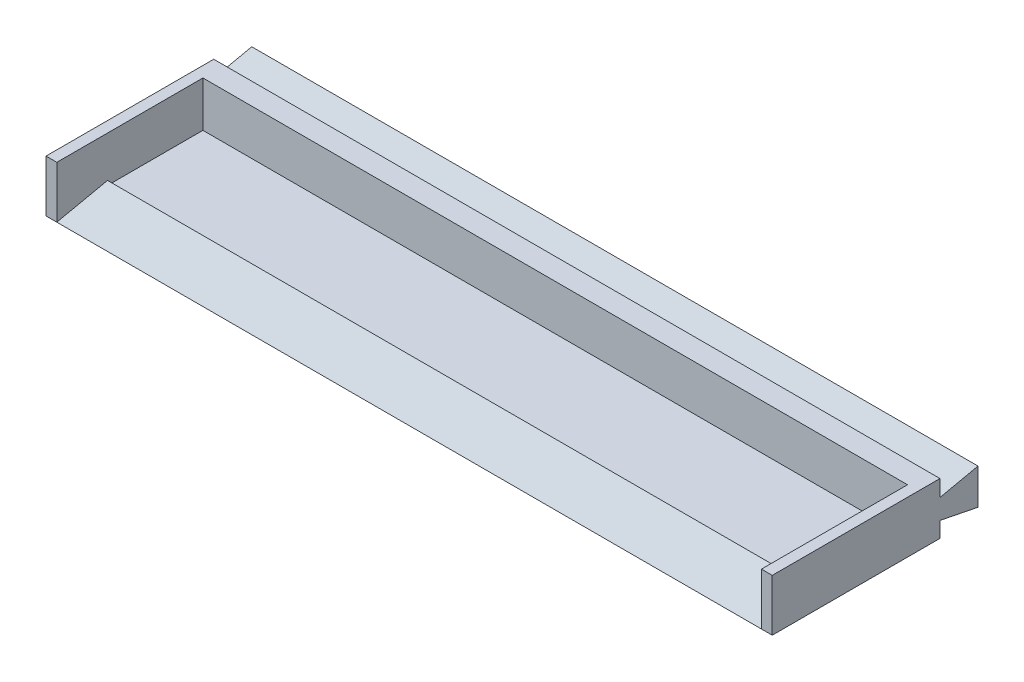
from build123d import *

# Parameters (mm, degrees)
SKETCH1_W           = 163
SKETCH1_H           = 38.8
BOSS_EXTRUDE1_DEPTH = 2.5
CUT_EXTRUDE1_DEPTH  = 168
SKETCH4_W           = 27.063305406
SKETCH4_H           = 1
CUT_EXTRUDE2_DEPTH  = 168
SKETCH5_W           = 163
SKETCH5_H           = 5
BOSS_EXTRUDE2_DEPTH = 10.5
SKETCH6_W           = 38.8
SKETCH6_H           = 12
BOSS_EXTRUDE3_DEPTH = 2.5
SKETCH7_W           = 38.8
SKETCH7_H           = 12
BOSS_EXTRUDE4_DEPTH = 2.5
SKETCH8_W           = 168
SKETCH8_H           = 12
BOSS_EXTRUDE5_DEPTH = 8.8
SKETCH9_W           = 8.8
SKETCH9_H           = 1.9
SKETCH9_W_2         = 9
SKETCH9_H_2         = 1.8
CUT_EXTRUDE3_DEPTH  = 176.025026782


with BuildPart() as part:
    # Sketch1 → Boss-Extrude1 (new body)
    with BuildSketch(Plane(origin=(0, 0, 0), x_dir=(1, 0, 0), z_dir=(0, 1, 0))):
        with Locations((81.5, 19.4)):
            Rectangle(SKETCH1_W, SKETCH1_H)
    extrude(amount=BOSS_EXTRUDE1_DEPTH)

    # Sketch3 → Cut-Extrude1 (cut)
    with BuildSketch(Plane(origin=(163, 0, 0), x_dir=(0, 0, -1), z_dir=(1, 0, 0))):
        Polygon((0, 0), (11.736694594, 2.5), (0, 2.5), align=None)
    extrude(amount=-CUT_EXTRUDE1_DEPTH, mode=Mode.SUBTRACT)

    # Sketch4 → Cut-Extrude2 (cut)
    with BuildSketch(Plane(origin=(163, 0, 0), x_dir=(0, 0, -1), z_dir=(1, 0, 0))):
        with Locations((25.268347297, 2)):
            Rectangle(SKETCH4_W, SKETCH4_H)
    extrude(amount=-CUT_EXTRUDE2_DEPTH, mode=Mode.SUBTRACT)

    # Sketch5 → Boss-Extrude2 (add)
    with BuildSketch(Plane(origin=(0, 1.5, 0), x_dir=(1, 0, 0), z_dir=(0, 1, 0))):
        with Locations((81.5, 36.3)):
            Rectangle(SKETCH5_W, SKETCH5_H)
    extrude(amount=BOSS_EXTRUDE2_DEPTH)

    # Sketch6 → Boss-Extrude3 (add)
    with BuildSketch(Plane.ZY):
        with Locations((-19.4, 6)):
            Rectangle(SKETCH6_W, SKETCH6_H)
    extrude(amount=BOSS_EXTRUDE3_DEPTH)

    # Sketch7 → Boss-Extrude4 (add)
    with BuildSketch(Plane(origin=(163, 0, 0), x_dir=(0, 0, -1), z_dir=(1, 0, 0))):
        with Locations((19.4, 6)):
            Rectangle(SKETCH7_W, SKETCH7_H)
    extrude(amount=BOSS_EXTRUDE4_DEPTH)

    # Sketch8 → Boss-Extrude5 (add)
    with BuildSketch(Plane(origin=(0, 0, -38.8), x_dir=(-1, 0, 0), z_dir=(0, 0, -1))):
        with Locations((-81.5, 6)):
            Rectangle(SKETCH8_W, SKETCH8_H)
    extrude(amount=BOSS_EXTRUDE5_DEPTH)

    # Sketch9 → Cut-Extrude3 (cut, through all)
    with BuildSketch(Plane(origin=(165.5, 0, 0), x_dir=(0, 0, -1), z_dir=(1, 0, 0))):
        with Locations((43.2, 11.05)):
            Rectangle(SKETCH9_W, SKETCH9_H)
        Polygon((47.8, 1.8), (38.8, 3.6), (38.8, 1.8), align=None)
        Polygon((47.6, 10.1), (38.8, 10.1), (38.8, 8.2), align=None)
        with Locations((43.3, 0.9)):
            Rectangle(SKETCH9_W_2, SKETCH9_H_2)
    extrude(amount=-CUT_EXTRUDE3_DEPTH, mode=Mode.SUBTRACT)


solid = part.part
